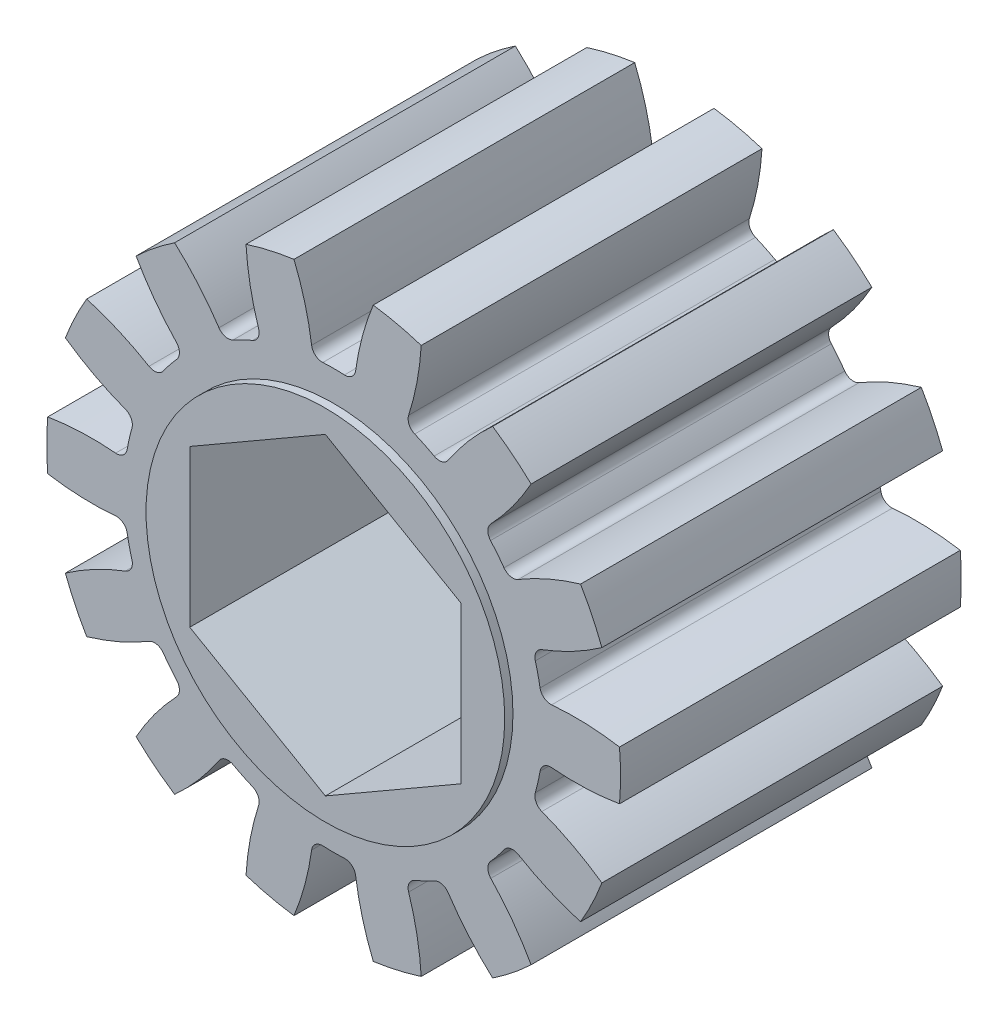
from build123d import *

# Parameters (mm, degrees)
CROQUIS1_R                 = 10.16
SALIENTE_EXTRUIR1_DEPTH    = 6.0325
CORTAR_EXTRUIR1_DEPTH      = 16.583396814
REDONDEO1_R                = 0.381028065
MATRIZC1_COUNT             = 14
REDONDEO1_OF_MATRIZC1_R    = 0.381028065
CROQUIS3_R                 = 6.35
SALIENTE_EXTRUIR2_DEPTH    = 6.3246
CORTAR_EXTRUIR2_DEPTH      = 16.635943497
CORTAR_EXTRUIR2_DEPTH_BACK = 16.635943497


with BuildPart() as part:
    # Croquis1 → Saliente-Extruir1 (new, symmetric)
    with BuildSketch(Plane.XY):
        with Locations(Location((0, 0, 0), (0, 0, 180))):
            Circle(CROQUIS1_R)
    extrude(amount=SALIENTE_EXTRUIR1_DEPTH, both=True)

    # Croquis2 → Cortar-Extruir1 (cut, symmetric)
    with BuildSketch(Plane.XY):
        with BuildLine():
            ThreePointArc((0.737043747, 7.383916257), (0, 7.42061), (-0.737043747, 7.383916257))
            ThreePointArc((-0.737043747, 7.383916257), (-0.973357597, 8.747341873), (-1.403224912, 10.062631855))
            ThreePointArc((-1.403224912, 10.062631855), (0, 10.16), (1.403224912, 10.062631855))
            ThreePointArc((1.403224912, 10.062631855), (0.973357597, 8.747341873), (0.737043747, 7.383916257))
        make_face()
    cortar_extruir1 = extrude(amount=CORTAR_EXTRUIR1_DEPTH, both=True, mode=Mode.SUBTRACT)

    # Redondeo1
    redondeo1_edges = [part.edges().sort_by_distance(p)[0] for p in [
        (0.737043747, 7.383916257, 0),
        (-0.737043747, 7.383916257, 0),
    ]]
    fillet(redondeo1_edges, radius=REDONDEO1_R)

    # MatrizC1: Cortar-Extruir1 ×14 about axis
    matrizc1_axis = Axis((0, 0, 0), (0, 0, 1))
    for i in range(1, MATRIZC1_COUNT):
        add(cortar_extruir1.rotate(matrizc1_axis, i * 360 / MATRIZC1_COUNT), mode=Mode.SUBTRACT)

    # Redondeo1 of MatrizC1
    redondeo1_of_matrizc1_edges = [part.edges().sort_by_distance(p)[0] for p in [
        (-2.539707725, 6.972469967, 0),
        (-3.867814665, 6.332887374, 0),
        (-5.313438934, 5.180040489, 0),
        (-6.232517453, 4.027552479, 0),
        (-7.034778397, 2.361640463, 0),
        (-7.362793723, 0.924511421, 0),
        (-7.362793723, -0.924511421, 0),
        (-7.034778397, -2.361640463, 0),
        (-6.232517453, -4.027552479, 0),
        (-5.313438934, -5.180040489, 0),
        (-3.867814665, -6.332887374, 0),
        (-2.539707725, -6.972469967, 0),
        (-0.737043747, -7.383916257, 0),
        (0.737043747, -7.383916257, 0),
        (2.539707725, -6.972469967, 0),
        (3.867814665, -6.332887374, 0),
        (5.313438934, -5.180040489, 0),
        (6.232517453, -4.027552479, 0),
        (7.034778397, -2.361640463, 0),
        (7.362793723, -0.924511421, 0),
        (7.362793723, 0.924511421, 0),
        (7.034778397, 2.361640463, 0),
        (6.232517453, 4.027552479, 0),
        (5.313438934, 5.180040489, 0),
        (3.867814665, 6.332887374, 0),
        (2.539707725, 6.972469967, 0),
    ]]
    fillet(redondeo1_of_matrizc1_edges, radius=REDONDEO1_OF_MATRIZC1_R)

    # Croquis3 → Saliente-Extruir2 (add, symmetric)
    with BuildSketch(Plane.XY):
        Circle(CROQUIS3_R)
    extrude(amount=SALIENTE_EXTRUIR2_DEPTH, both=True)

    # Croquis4 → Cortar-Extruir2 (cut, two sides: drawn at the far end of the back side and taken through both)
    with BuildSketch(Plane.XY.offset(-CORTAR_EXTRUIR2_DEPTH_BACK)):
        Polygon((0, 5.543255405), (-4.8006, 2.771627702), (-4.8006, -2.771627702), (0, -5.543255405), (4.8006, -2.771627702), (4.8006, 2.771627702), align=None)
    extrude(amount=CORTAR_EXTRUIR2_DEPTH + CORTAR_EXTRUIR2_DEPTH_BACK, mode=Mode.SUBTRACT)


solid = part.part
